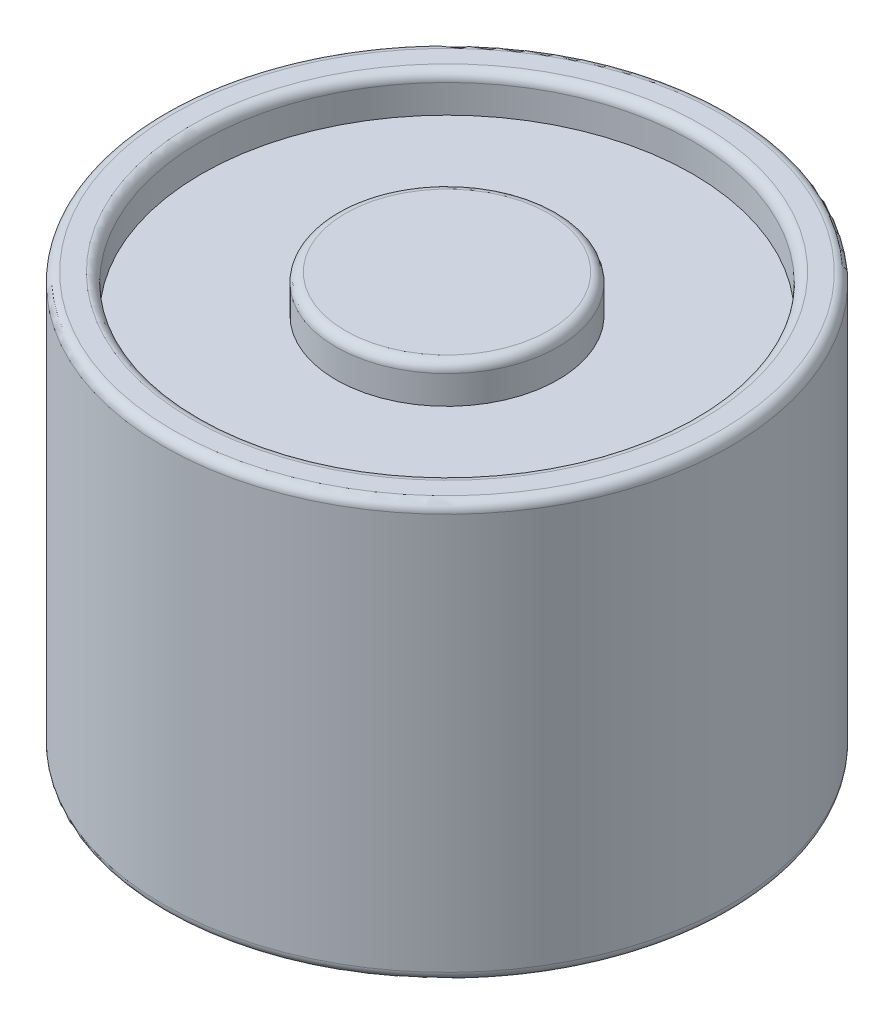
from build123d import *

# Parameters (mm, degrees)
SKETCH1_R           = 15
BOSS_EXTRUDE1_DEPTH = 22
SKETCH2_R           = 13
SKETCH2_R_2         = 5.88031104
CUT_EXTRUDE1_DEPTH  = 2
FILLET1_R           = 0.5


with BuildPart() as part:
    # Sketch1 → Boss-Extrude1 (new body)
    with BuildSketch(Plane(origin=(0, 0, 0), x_dir=(1, 0, 0), z_dir=(0, 1, 0))):
        with Locations(Location((0, 0, 0), (0, 0, 270))):
            Circle(SKETCH1_R)
    extrude(amount=BOSS_EXTRUDE1_DEPTH)

    # Sketch2 → Cut-Extrude1 (cut)
    with BuildSketch(Plane(origin=(0, 22, 0), x_dir=(1, 0, 0), z_dir=(0, 1, 0))):
        with Locations(Location((0, 0, 0), (0, 0, 270))):
            Circle(SKETCH2_R)
        with Locations(Location((0, 0, 0), (0, 0, 270))):
            Circle(SKETCH2_R_2, mode=Mode.SUBTRACT)
    extrude(amount=-CUT_EXTRUDE1_DEPTH, mode=Mode.SUBTRACT)

    # Fillet1
    fillet1_edges = [part.edges().sort_by_distance(p)[0] for p in [
        (0, 0, -15),
        (0, 22, -15),
        (0, 22, -13),
        (0, 22, -5.88031104),
    ]]
    fillet(fillet1_edges, radius=FILLET1_R)


solid = part.part
